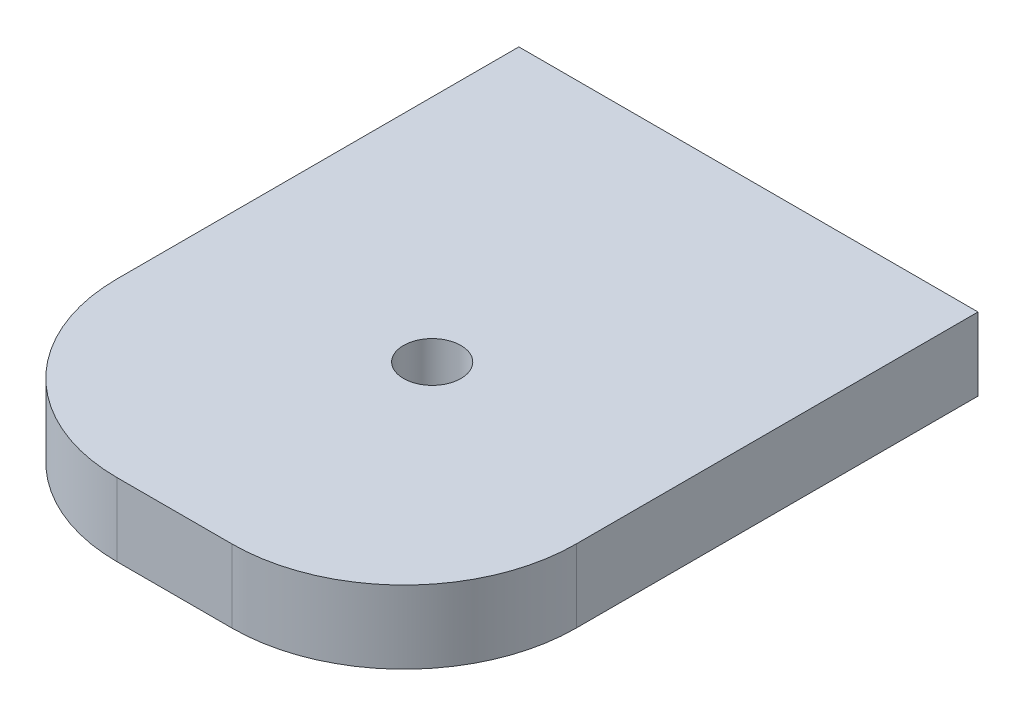
from build123d import *

# Parameters (mm, degrees)
SKETCH1_W           = 40
SKETCH1_H           = 50
SKETCH1_R           = 2.5
BOSS_EXTRUDE1_DEPTH = 6.35
FILLET1_R           = 15


with BuildPart() as part:
    # Sketch1 → Boss-Extrude1 (new body)
    with BuildSketch(Plane(origin=(0, 0, 0), x_dir=(1, 0, 0), z_dir=(0, 1, 0))):
        with Locations((1.322957198, 0.214007782)):
            Rectangle(SKETCH1_W, SKETCH1_H)
        with Locations(Location((1.322957198, -2.33463035, 0), (0, 0, 270))):
            Circle(SKETCH1_R, mode=Mode.SUBTRACT)
    extrude(amount=BOSS_EXTRUDE1_DEPTH)

    # Fillet1
    fillet1_edges = [part.edges().sort_by_distance(p)[0] for p in [
        (21.322957198, 3.175, 24.785992218),
        (-18.677042802, 3.175, 24.785992218),
    ]]
    fillet(fillet1_edges, radius=FILLET1_R)


solid = part.part
